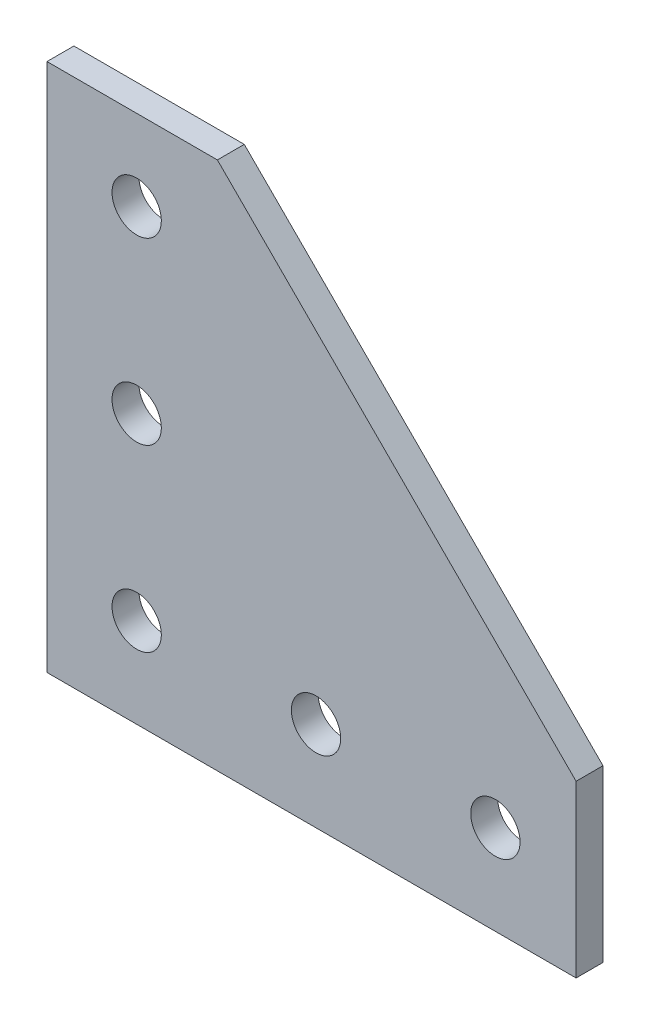
from build123d import *

# Parameters (mm, degrees)
SCHIZZO1_W                   = 59
SCHIZZO1_H                   = 59
ESTRUSIONE_ESTRUSIONE1_DEPTH = 3
FORO_PER_VITE_M5_1_D         = 5.5
SMUSSO1_SIZE                 = 40


with BuildPart() as part:
    # Schizzo1 → Estrusione-Estrusione1 (new body)
    with BuildSketch(Plane.XY):
        with Locations((29.5, 29.5)):
            Rectangle(SCHIZZO1_W, SCHIZZO1_H)
    extrude(amount=ESTRUSIONE_ESTRUSIONE1_DEPTH)

    # Foro per Vite M5-1 (through all)
    with Locations(Plane.XY.offset(3)):
        with Locations((10, 10), (10, 30), (30, 10), (50, 10), (10, 50)):
            Hole(FORO_PER_VITE_M5_1_D / 2)

    # Smusso1
    smusso1_edges = [part.edges().sort_by_distance(p)[0] for p in [
        (59, 59, 1.5),
    ]]
    chamfer(smusso1_edges, length=SMUSSO1_SIZE)


solid = part.part
